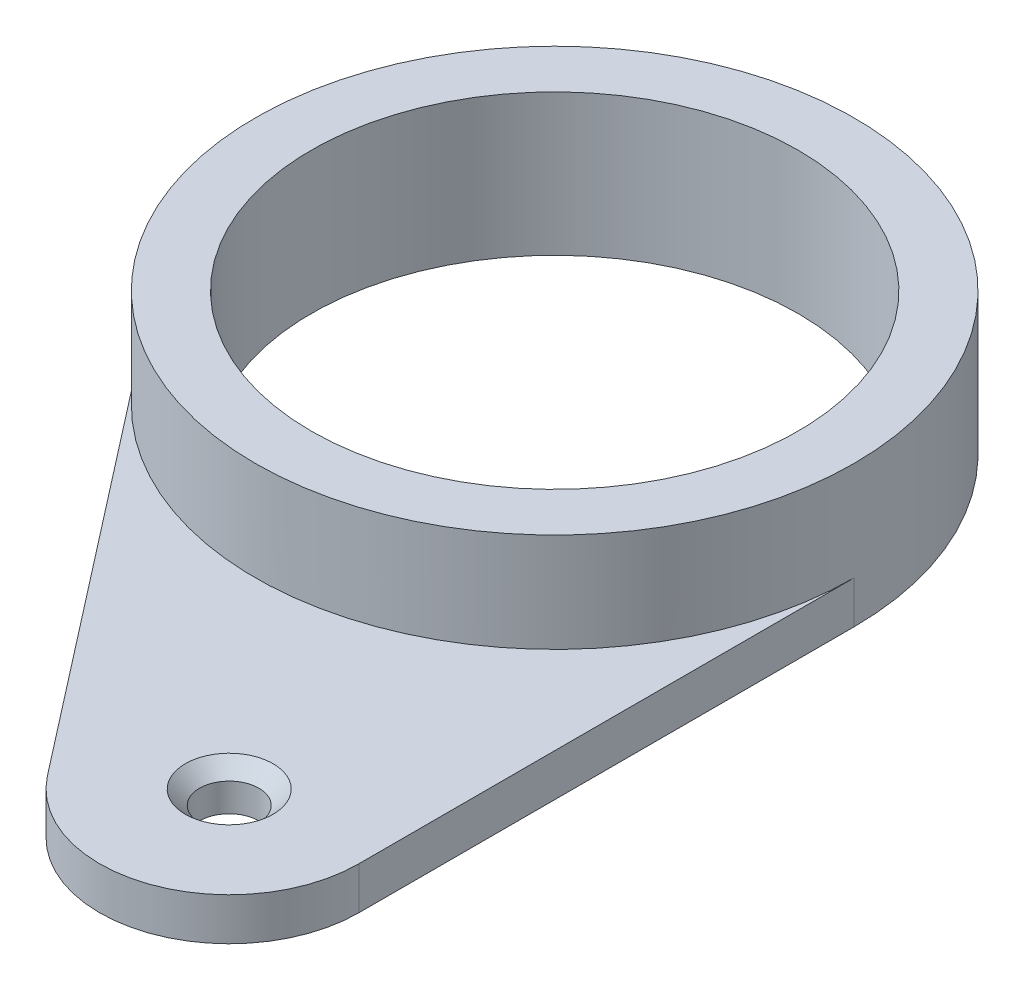
from build123d import *
from build123d.topology import SkipClean

# Parameters (mm, degrees)
SKETCH1_R           = 17.2
SKETCH1_R_2         = 2.1
BOSS_EXTRUDE1_DEPTH = 3
CHAMFER1_SIZE       = 1
SKETCH2_R           = 21.154971589
SKETCH2_R_2         = 17.2
BOSS_EXTRUDE2_DEPTH = 7


with BuildPart() as part:
    # Sketch1 → Boss-Extrude1 (new body)
    with BuildSketch(Plane(origin=(0, 0, 0), x_dir=(1, 0, 0), z_dir=(0, 1, 0))):
        with BuildLine():
            ThreePointArc((-29.22705293, 22.721503746), (-18.44573532, 55.149077376), (9.154971589, 35))
            Line((9.154971589, 35), (9.154971589, 0))
            ThreePointArc((9.154971589, 0), (2.966995431, -8.660856938), (-7.231849971, -5.613719871))
            Line((-7.231849971, -5.613719871), (-29.22705293, 22.721503746))
        make_face()
        with Locations(Location((-12, 35, 0), (0, 0, 270))):
            Circle(SKETCH1_R, mode=Mode.SUBTRACT)
        with Locations(Location((0, 0, 0), (0, 0, 270))):
            Circle(SKETCH1_R_2, mode=Mode.SUBTRACT)
    extrude(amount=BOSS_EXTRUDE1_DEPTH)

    # Chamfer1
    chamfer1_edges = [part.edges().sort_by_distance(p)[0] for p in [
        (0, 3, -2.1),
    ]]
    chamfer(chamfer1_edges, length=CHAMFER1_SIZE)

    # Sketch2 → Boss-Extrude2 (add)
    with SkipClean():  # the faces are left unmerged after this step: merging them gives an invalid solid
        with BuildSketch(Plane(origin=(0, 3, 0), x_dir=(1, 0, 0), z_dir=(0, 1, 0))):
            with Locations((-12, 35)):
                Circle(SKETCH2_R)
            with Locations(Location((-12, 35, 0), (0, 0, 270))):
                Circle(SKETCH2_R_2, mode=Mode.SUBTRACT)
        extrude(amount=BOSS_EXTRUDE2_DEPTH)


solid = part.part
